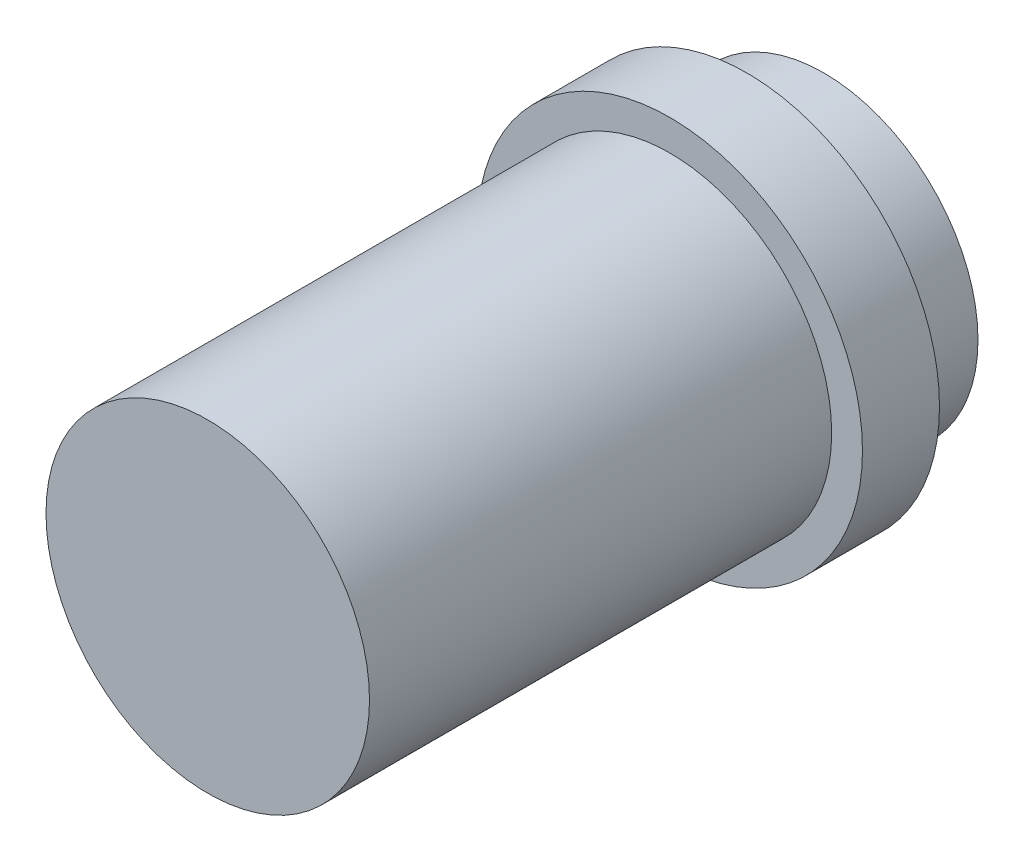
from build123d import *
from build123d.topology import SkipClean

# Parameters (mm, degrees)
SKETCH_1_R      = 2.5
SKETCH_1_R_2    = 1.25
EXTRUDE_1_DEPTH = 1
EXTRUDE_START   = 1
SKETCH_2_R      = 2
SKETCH_2_R_2    = 1.25
EXTRUDE_2_DEPTH = 1
SKETCH_4_R      = 2.1
SKETCH_4_R_2    = 1.25
EXTRUDE_3_DEPTH = 6
EXTRUDE_START_2 = -1
SKETCH_3_R      = 2.1
EXTRUDE_4_DEPTH = 1


with BuildPart() as part:
    # 草图1 → 凸台-拉伸1 (new body)
    with BuildSketch(Plane.XY):
        Circle(SKETCH_1_R)
        Circle(SKETCH_1_R_2, mode=Mode.SUBTRACT)
    extrude(amount=EXTRUDE_1_DEPTH)

    # 草图2 → 凸台-拉伸2 (add)
    with SkipClean():  # the faces are left unmerged after this step: merging them gives an invalid solid
        with BuildSketch(Plane(origin=(0, 0, 0), x_dir=(-1, 0, 0), z_dir=(0, 0, -1)).offset(EXTRUDE_START)):
            with Locations(Location((0, 0, 0), (0, 0, 180))):
                Circle(SKETCH_2_R)
            Circle(SKETCH_2_R_2, mode=Mode.SUBTRACT)
        extrude(amount=-EXTRUDE_2_DEPTH)

    # 草图4 → 凸台-拉伸3 (add)
    with BuildSketch(Plane.XY.offset(1)):
        Circle(SKETCH_4_R)
        with Locations(Location((0, 0, 0), (0, 0, 180))):
            Circle(SKETCH_4_R_2, mode=Mode.SUBTRACT)
    extrude(amount=EXTRUDE_3_DEPTH)

    # 草图3 → 凸台-拉伸4 (add)
    with BuildSketch(Plane.XY.offset(7).offset(EXTRUDE_START_2)):
        Circle(SKETCH_3_R)
    extrude(amount=EXTRUDE_4_DEPTH)


solid = part.part
